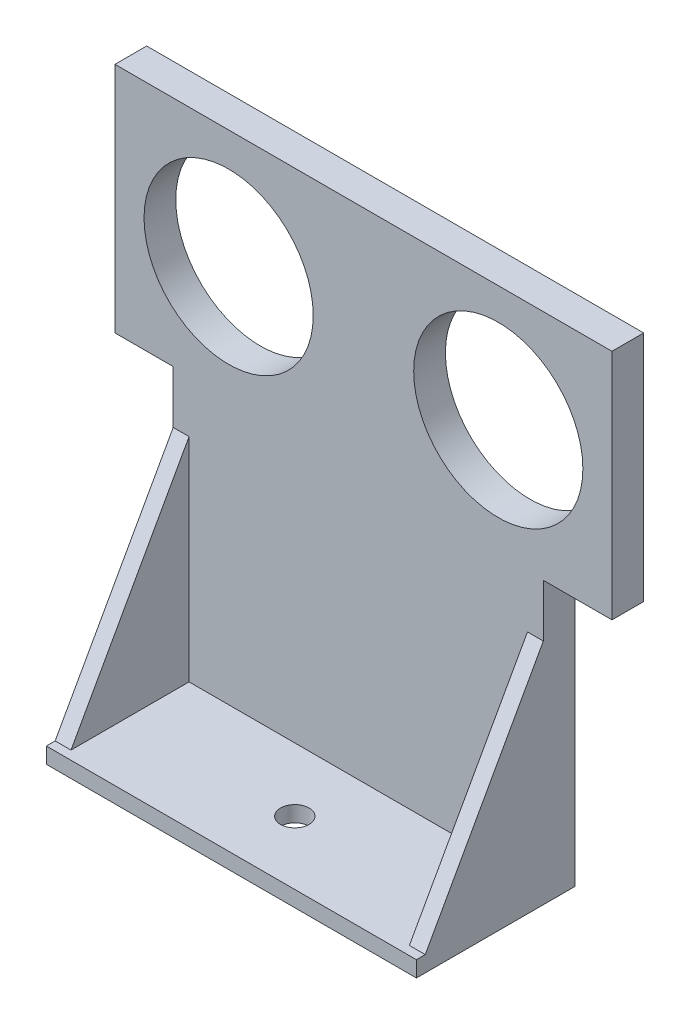
from build123d import *

# Parameters (mm, degrees)
BOSS_EXTRUDE3_DEPTH = 1.5
BOSS_EXTRUDE4_DEPTH = 1.5
SKETCH2_W           = 35
SKETCH2_H           = 12
SKETCH2_R           = 1.35
BOSS_EXTRUDE7_DEPTH = 1.5
SKETCH3_R           = 8
BOSS_EXTRUDE8_DEPTH = 3


with BuildPart() as part:
    # Sketch5 → Boss-Extrude3 (new body)
    with BuildSketch(Plane(origin=(-17.5, 0, 0), x_dir=(0, 1, 0), z_dir=(-1, 0, 0))):
        Polygon((21.59, 6), (0, -6), (0, 6), align=None)
    extrude(amount=-BOSS_EXTRUDE3_DEPTH)



with BuildPart() as body_2:
    # Sketch4 → Boss-Extrude4 (new body)
    with BuildSketch(Plane(origin=(17.5, 0, 0), x_dir=(0, 0, -1), z_dir=(1, 0, 0))):
        Polygon((6, 21.592468158), (-6, 0), (6, 0), align=None)
    extrude(amount=-BOSS_EXTRUDE4_DEPTH)


with BuildPart() as part_1:
    add(part.part)

    add(body_2.part)  # Boss-Extrude7 merges body 2
    # Sketch2 → Boss-Extrude7 (add)
    with BuildSketch(Plane(origin=(0, 0, 0), x_dir=(1, 0, 0), z_dir=(0, 1, 0))):
        Rectangle(SKETCH2_W, SKETCH2_H)
        with Locations(Location((0, 0, 0), (0, 0, 270))):
            Circle(SKETCH2_R, mode=Mode.SUBTRACT)
    extrude(amount=BOSS_EXTRUDE7_DEPTH)

    # Sketch3 → Boss-Extrude8 (add)
    with BuildSketch(Plane(origin=(0, 0, -6), x_dir=(-1, 0, 0), z_dir=(0, 0, -1))):
        Polygon((17.5, 0), (-17.5, 0), (-17.5, 26.57366529), (-23.990187259, 26.57366529), (-23.990187259, 48.57366529), (23.009812741, 48.57366529), (23.009812741, 26.57366529), (17.5, 26.57366529), align=None)
        with Locations((-13.240187259, 37.57366529)):
            Circle(SKETCH3_R, mode=Mode.SUBTRACT)
        with Locations(Location((12.259812741, 37.374598913, 0), (0, 0, 180))):
            Circle(SKETCH3_R, mode=Mode.SUBTRACT)
    extrude(amount=BOSS_EXTRUDE8_DEPTH)


solid = part_1.part
